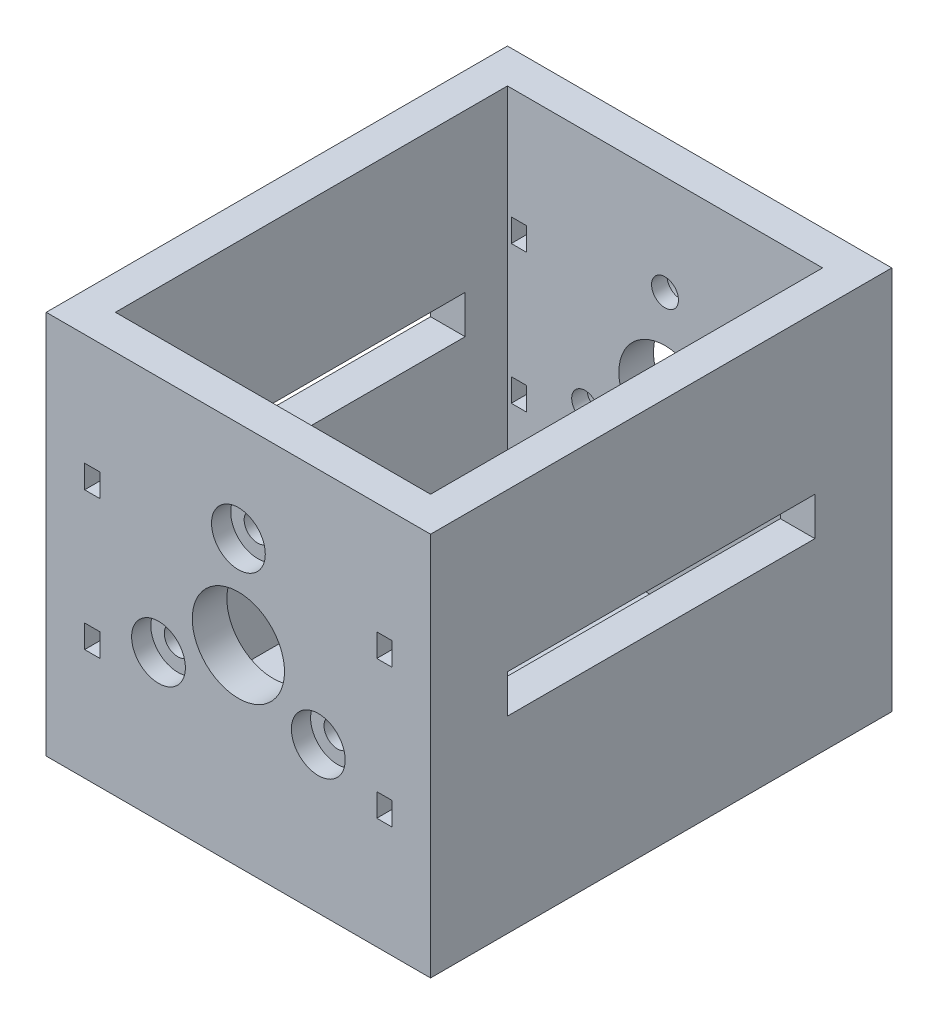
from build123d import *

# Parameters (mm, degrees)
SKETCH1_W                                  = 50
SKETCH1_H                                  = 50
BOSS_EXTRUDE1_DEPTH                        = 30
SKETCH3_R                                  = 6
CUT_EXTRUDE1_DEPTH                         = 70
SKETCH5_W                                  = 41
SKETCH5_H                                  = 51
CUT_EXTRUDE3_DEPTH                         = 48
SKETCH7_R                                  = 1.75
CUT_EXTRUDE5_DEPTH                         = 60
CIRPATTERN3_COUNT                          = 3
SKETCH8_W                                  = 2
SKETCH8_H                                  = 3
CUT_EXTRUDE6_DEPTH                         = 60
MIRROR1_AT_THE_SECOND_PLANE_COPY_1_SKETC_W = 2
MIRROR1_AT_THE_SECOND_PLANE_COPY_1_SKETC_H = 3
MIRROR1_AT_THE_SECOND_PLANE_COPY_1_DEPTH   = 60
SKETCH9_W                                  = 40
SKETCH9_H                                  = 5
CUT_EXTRUDE7_DEPTH                         = 60
SKETCH10_R                                 = 3.5
CUT_EXTRUDE8_DEPTH                         = 2.5
CIRPATTERN4_COUNT                          = 3
MIRROR2_COPY_1_SKETCH_R                    = 3.5
MIRROR2_COPY_1_DEPTH                       = 2.5
MIRROR2_COPY_2_SKETCH_R                    = 3.5
MIRROR2_COPY_2_DEPTH                       = 2.5


with BuildPart() as part:
    # Sketch1 → Boss-Extrude1 (new, symmetric)
    with BuildSketch(Plane.XY):
        Rectangle(SKETCH1_W, SKETCH1_H)
    extrude(amount=BOSS_EXTRUDE1_DEPTH, both=True)

    # Sketch3 → Cut-Extrude1 (cut)
    with BuildSketch(Plane.XY.offset(30)):
        Circle(SKETCH3_R)
    extrude(amount=-CUT_EXTRUDE1_DEPTH, mode=Mode.SUBTRACT)

    # Sketch5 → Cut-Extrude3 (cut)
    with BuildSketch(Plane(origin=(0, 25, 0), x_dir=(1, 0, 0), z_dir=(0, 1, 0))):
        Rectangle(SKETCH5_W, SKETCH5_H)
    extrude(amount=-CUT_EXTRUDE3_DEPTH, mode=Mode.SUBTRACT)

    # Sketch7 → Cut-Extrude5 (cut)
    with BuildSketch(Plane.XY.offset(30)):
        with Locations((0, 12)):
            Circle(SKETCH7_R)
    cut_extrude5 = extrude(amount=-CUT_EXTRUDE5_DEPTH, mode=Mode.SUBTRACT)

    # CirPattern3: Cut-Extrude5 ×3 about axis
    cirpattern3_axis = Axis((0, 0, 0), (0, 0, 1))
    for i in range(1, CIRPATTERN3_COUNT):
        add(cut_extrude5.rotate(cirpattern3_axis, i * 360 / CIRPATTERN3_COUNT), mode=Mode.SUBTRACT)

    # Sketch8 → Cut-Extrude6 (cut)
    with BuildSketch(Plane.XY.offset(30)):
        with Locations((19, 9)):
            Rectangle(SKETCH8_W, SKETCH8_H)
    cut_extrude6 = extrude(amount=-CUT_EXTRUDE6_DEPTH, mode=Mode.SUBTRACT)

    # Mirror1: Cut-Extrude6 across plane
    add(cut_extrude6.mirror(Plane.ZX), mode=Mode.SUBTRACT)

    # Mirror1 at the second plane: Cut-Extrude6 across plane
    add(cut_extrude6.mirror(Plane(origin=(0, 0, 0), x_dir=(0, 0, 1), z_dir=(1, 0, 0))), mode=Mode.SUBTRACT)

    # Mirror1 at the second plane copy 1 sketc → Mirror1 at the second plane copy 1 (cut)
    with BuildSketch(Plane(origin=(0, 0, 30), x_dir=(-1, 0, 0), z_dir=(0, 0, 1))):
        with Locations((19, 9)):
            Rectangle(MIRROR1_AT_THE_SECOND_PLANE_COPY_1_SKETC_W, MIRROR1_AT_THE_SECOND_PLANE_COPY_1_SKETC_H)
    extrude(amount=-MIRROR1_AT_THE_SECOND_PLANE_COPY_1_DEPTH, mode=Mode.SUBTRACT)

    # Sketch9 → Cut-Extrude7 (cut)
    with BuildSketch(Plane(origin=(25, 0, 0), x_dir=(0, 0, -1), z_dir=(1, 0, 0))):
        with Locations((0, 2)):
            Rectangle(SKETCH9_W, SKETCH9_H)
    extrude(amount=-CUT_EXTRUDE7_DEPTH, mode=Mode.SUBTRACT)

    # Sketch10 → Cut-Extrude8 (cut)
    with BuildSketch(Plane.XY.offset(30)):
        with Locations((0, 12)):
            Circle(SKETCH10_R)
    cut_extrude8 = extrude(amount=-CUT_EXTRUDE8_DEPTH, mode=Mode.SUBTRACT)

    # CirPattern4: Cut-Extrude8 ×3 about axis
    cirpattern4_axis = Axis((0, 0, 0), (0, 0, 1))
    for i in range(1, CIRPATTERN4_COUNT):
        add(cut_extrude8.rotate(cirpattern4_axis, i * 360 / CIRPATTERN4_COUNT), mode=Mode.SUBTRACT)

    # Mirror2: Cut-Extrude8 across plane
    add(cut_extrude8.mirror(Plane.XY), mode=Mode.SUBTRACT)

    # Mirror2 copy 1 sketch → Mirror2 copy 1 (cut)
    with BuildSketch(Plane(origin=(0, 0, -30), x_dir=(-0.4999999999999998, 0.8660254037844387, 0), z_dir=(0, 0, -1))):
        with Locations((0, -12)):
            Circle(MIRROR2_COPY_1_SKETCH_R)
    extrude(amount=-MIRROR2_COPY_1_DEPTH, mode=Mode.SUBTRACT)

    # Mirror2 copy 2 sketch → Mirror2 copy 2 (cut)
    with BuildSketch(Plane(origin=(0, 0, -30), x_dir=(-0.5000000000000004, -0.8660254037844384, 0), z_dir=(0, 0, -1))):
        with Locations((0, -12)):
            Circle(MIRROR2_COPY_2_SKETCH_R)
    extrude(amount=-MIRROR2_COPY_2_DEPTH, mode=Mode.SUBTRACT)


solid = part.part
